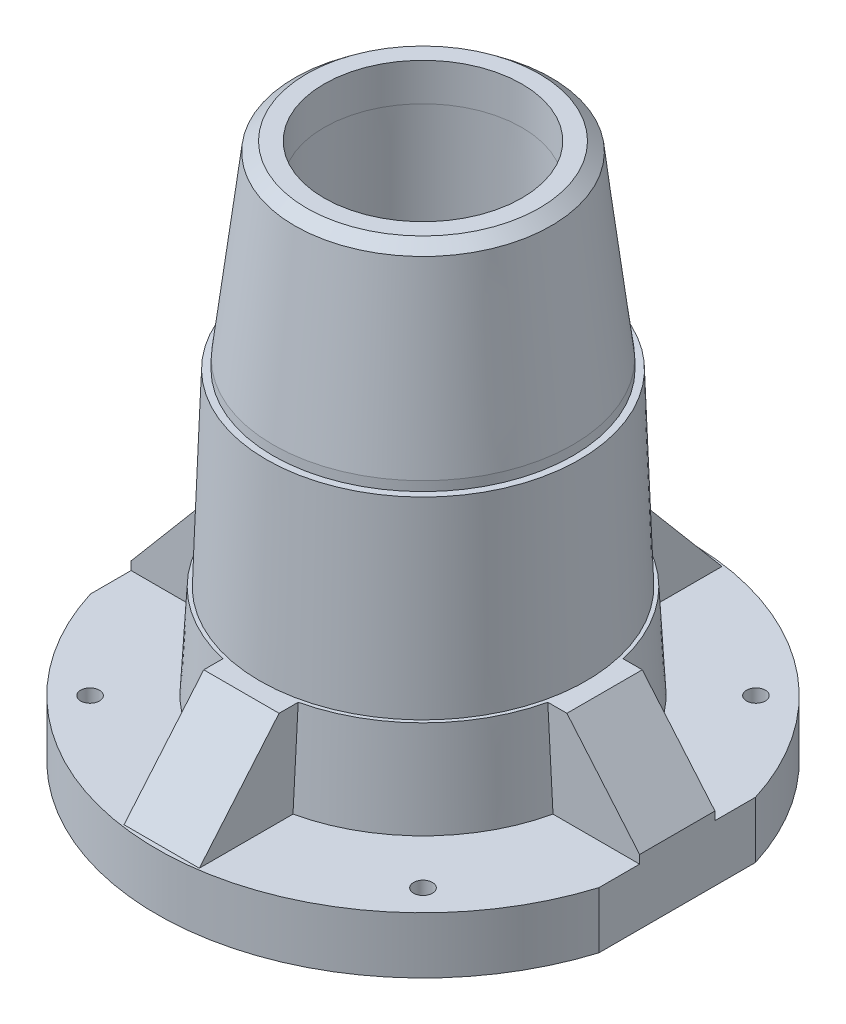
from build123d import *

# Parameters (mm, degrees)
RIB1_REACH          = 71.607
SKETCH3_WALL_W      = 156.928914452
SKETCH3_WALL_H      = 8
CHAMFER1_SIZE       = 2
CHAMFER1_SIZE2      = 20
CHAMFER2_SIZE       = 1
CHAMFER2_SIZE2      = 1.144674394
CIRPATTERN23_COUNT  = 4
CUT_EXTRUDE7_REACH  = 71.607
SKETCH5_R           = 1
CIRPATTERN24_COUNT  = 4
SKETCH4_OUTSIDE_W   = 79.882
SKETCH4_OUTSIDE_H   = 79.882
SKETCH4_OUTSIDE_R   = 16.631613782
CUT_EXTRUDE8_DEPTH  = 20
CUT_EXTRUDE8_DRAFT  = -2
SKETCH7_OUTSIDE_W   = 78.484
SKETCH7_OUTSIDE_H   = 78.484
SKETCH7_OUTSIDE_W_2 = 54
SKETCH7_OUTSIDE_H_2 = 56.5
CUT_EXTRUDE9_DEPTH  = 57


with BuildPart() as part:
    # Sketch1 → Revolve1 (revolve)
    with BuildSketch(Plane(origin=(0, 0, 0), x_dir=(0, 0, -1), z_dir=(1, 0, 0))):
        Polygon((10.5, 57), (15.5, 57), (15.921613782, 36.013708049), (16.631613782, 36.013708049), (18.25, 6), (28.25, 6), (28.25, 0), (23.75, 0), (23.75, -3), (19.25, -3), (19.25, 0), (13.75, 0), (13.75, 6.707783598), (12.75, 6.707783598), (12.75, 8.013708049), (11.75, 8.013708049), (11.75, 36.013708049), (10.75, 36.013708049), (10.5, 53), align=None)
    revolve(axis=Axis((0, 0, 0), (0, 1, 0)))

    # Sketch3 wall → Rib1 (add, up to next)
    with BuildSketch(Plane(origin=(22.676470588, 12, 0), x_dir=(0.645690512921, -0.763599215245, 0), z_dir=(0.763599215245, 0.645690512921, 0)), mode=Mode.PRIVATE) as rib1_sk1:
        Rectangle(SKETCH3_WALL_W, SKETCH3_WALL_H)
    rib1_tool1 = extrude(rib1_sk1.sketch, amount=-RIB1_REACH, mode=Mode.PRIVATE) - part.part
    rib1 = rib1_tool1.solids().sort_by_distance((22.676470588, 12, 0))[0]
    add(rib1)

    # Chamfer1
    chamfer1_edges = [part.edges().sort_by_distance(p)[0] for p in [
        (0, 57, 15.5),
    ]]
    chamfer1_side = [part.faces().sort_by_distance(p)[0] for p in [
        (0, 57, 10.938406204),
    ]]
    chamfer(chamfer1_edges, length=CHAMFER1_SIZE, length2=CHAMFER1_SIZE2, reference=chamfer1_side[0])

    # Chamfer2
    chamfer2_edges = [part.edges().sort_by_distance(p)[0] for p in [
        (0, 57, 13.5),
    ]]
    chamfer2_side = [part.faces().sort_by_distance(p)[0] for p in [
        (0, 47.002017422, 14.700859078),
    ]]
    chamfer(chamfer2_edges, length=CHAMFER2_SIZE, length2=CHAMFER2_SIZE2, reference=chamfer2_side[0])

    # CirPattern23: Rib1 ×4 about axis
    cirpattern23_axis = Axis((0, 0, 0), (0, 1, 0))
    for i in range(1, CIRPATTERN23_COUNT):
        add(rib1.rotate(cirpattern23_axis, i * 360 / CIRPATTERN23_COUNT))

    # Sketch5 → Cut-Extrude7 (cut, up to next)
    with BuildSketch(Plane.XZ, mode=Mode.PRIVATE) as cut_extrude7_sk1:
        with Locations(Location((17.67766953, -17.67766953, 0), (0, 0, 270))):
            Circle(SKETCH5_R)
    cut_extrude7_tool1 = extrude(cut_extrude7_sk1.sketch, amount=-CUT_EXTRUDE7_REACH, mode=Mode.PRIVATE) & part.part
    cut_extrude7 = cut_extrude7_tool1.solids().sort_by_distance((17.67767, 0, -17.67767))[0]
    add(cut_extrude7, mode=Mode.SUBTRACT)

    # CirPattern24: Cut-Extrude7 ×4 about axis
    cirpattern24_axis = Axis((0, 0, 0), (0, 1, 0))
    for i in range(1, CIRPATTERN24_COUNT):
        add(cut_extrude7.rotate(cirpattern24_axis, i * 360 / CIRPATTERN24_COUNT), mode=Mode.SUBTRACT)


with BuildPart() as cut_extrude8_tool:
    # Sketch4 outside → Cut-Extrude8 (with draft: the straight prism first)
    with BuildSketch(Plane(origin=(0, 36.013708049, 0), x_dir=(1, 0, 0), z_dir=(0, 1, 0))):
        Rectangle(SKETCH4_OUTSIDE_W, SKETCH4_OUTSIDE_H)
        Circle(SKETCH4_OUTSIDE_R, mode=Mode.SUBTRACT)
    extrude(amount=-CUT_EXTRUDE8_DEPTH)
    # Cut-Extrude8: the draft: its side faces are tilted about the plane it starts from
    cut_extrude8_sides = [cut_extrude8_tool.faces().sort_by_distance(p)[0] for p in [
        (0, 26.013708049, 39.941),
        (39.941, 26.013708049, 0),
        (0, 26.013708049, -39.941),
        (-39.941, 26.013708049, 0),
        (-16.631613782, 26.013708049, 0),
    ]]
    draft(cut_extrude8_sides, Plane(origin=(0, 36.013708049, 0), x_dir=(1, 0, 0), z_dir=(0, 1, 0)), CUT_EXTRUDE8_DRAFT)


with BuildPart() as part_1:
    add(part.part)

    # Cut-Extrude8: cut by cut_extrude8_tool
    add(cut_extrude8_tool.part, mode=Mode.SUBTRACT)

    # Sketch7 outside → Cut-Extrude9 (cut)
    with BuildSketch(Plane(origin=(0, 0, 0), x_dir=(1, 0, 0), z_dir=(0, 1, 0))):
        Rectangle(SKETCH7_OUTSIDE_W, SKETCH7_OUTSIDE_H)
        Rectangle(SKETCH7_OUTSIDE_W_2, SKETCH7_OUTSIDE_H_2, mode=Mode.SUBTRACT)
    extrude(amount=CUT_EXTRUDE9_DEPTH, mode=Mode.SUBTRACT)


solid = part_1.part
